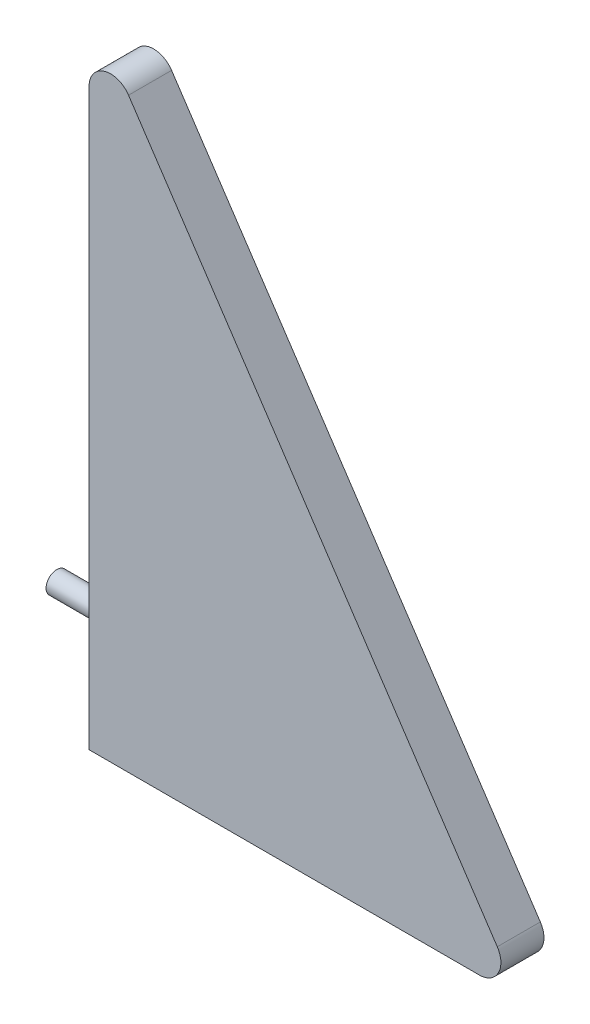
from build123d import *

# Parameters (mm, degrees)
BOSS_EXTRUDE1_DEPTH = 200
SKETCH2_R           = 50
BOSS_EXTRUDE2_DEPTH = 250


with BuildPart() as part:
    # Sketch1 → Boss-Extrude1 (new body)
    with BuildSketch(Plane.XY):
        with BuildLine():
            Line((0, 0), (1813.148290818, 0))
            ThreePointArc((1813.148290818, 0), (1901.315750695, 52.814207447), (1896.353320252, 155.470019623))
            Line((1896.353320252, 155.470019623), (183.205029434, 2725.192455849))
            ThreePointArc((183.205029434, 2725.192455849), (71.021585131, 2765.431638876), (0, 2669.722436227))
            Line((0, 2669.722436227), (0, 0))
        make_face()
    extrude(amount=BOSS_EXTRUDE1_DEPTH)

    # Sketch2 → Boss-Extrude2 (add)
    with BuildSketch(Plane.ZY):
        with Locations(Location((100, 500, 0), (0, 0, 90))):
            Circle(SKETCH2_R)
    extrude(amount=BOSS_EXTRUDE2_DEPTH)


solid = part.part
